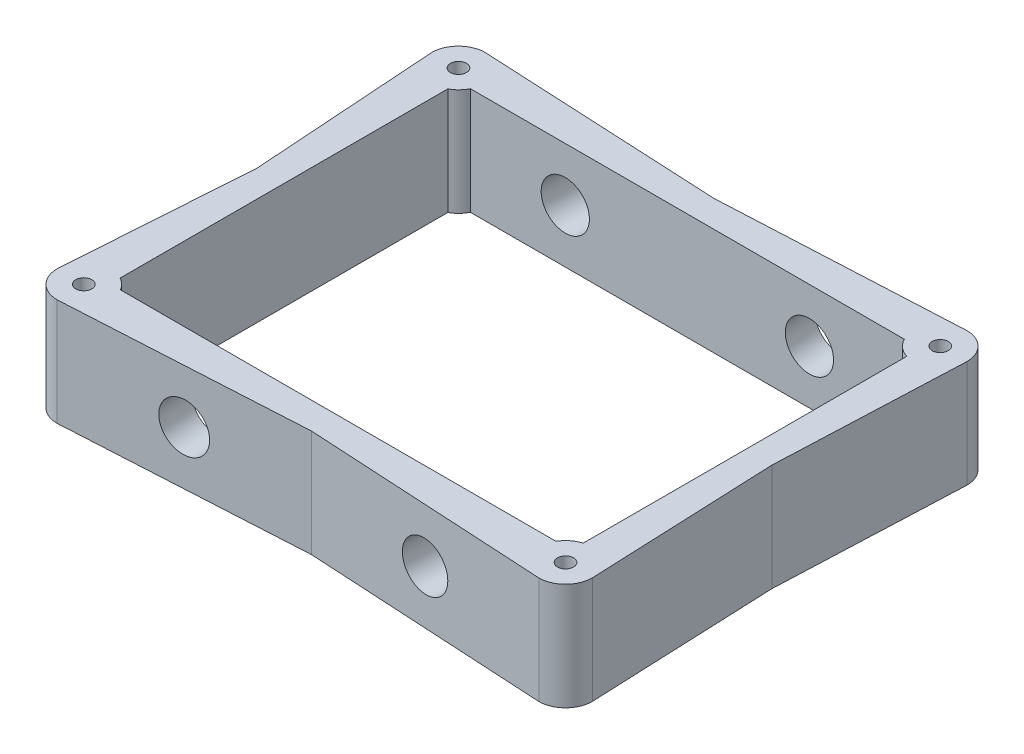
from build123d import *

# Parameters (mm, degrees)
SKETCH1_R                   = 1.5
BOSS_EXTRUDE3_DEPTH         = 20
M10X1_0_TAPPED_HOLE2_REACH  = 97.384
M10X1_0_TAPPED_HOLE2_BORE_R = 4.5
M10X1_0_TAPPED_HOLE3_REACH  = 97.384
M10X1_0_TAPPED_HOLE3_BORE_R = 4.5
M10X1_0_TAPPED_HOLE4_REACH  = 97.514
M10X1_0_TAPPED_HOLE4_BORE_R = 4.5
M10X1_0_TAPPED_HOLE5_REACH  = 97.514
M10X1_0_TAPPED_HOLE5_BORE_R = 4.5


with BuildPart() as part:
    # Sketch1 → Boss-Extrude3 (new body)
    with BuildSketch(Plane(origin=(0, 0, 0), x_dir=(1, 0, 0), z_dir=(0, 1, 0))):
        with BuildLine():
            Line((-44.503051854, 39.975242963), (-45, 40))
            ThreePointArc((-45, 40), (-48.535533906, 38.535533906), (-50, 35))
            Line((-50, 35), (-49.953621428, 34.32056292))
            Line((-49.953621428, 34.32056292), (-47.610889869, 0))
            Line((-47.610889869, 0), (-49.953621428, -34.32056292))
            Line((-49.953621428, -34.32056292), (-50, -35))
            ThreePointArc((-50, -35), (-48.535533906, -38.535533906), (-45, -40))
            Line((-45, -40), (0, -37.473505635))
            Line((0, -37.473505635), (45, -40))
            ThreePointArc((45, -40), (48.535533906, -38.535533906), (50, -35))
            Line((50, -35), (49.982372149, -34.580514872))
            Line((49.982372149, -34.580514872), (48.529209365, 0))
            Line((48.529209365, 0), (49.982372149, 34.580514872))
            Line((49.982372149, 34.580514872), (50, 35))
            ThreePointArc((50, 35), (48.535533906, 38.535533906), (45, 40))
            Line((45, 40), (44.503051854, 39.975242963))
            Line((44.503051854, 39.975242963), (0, 37.758183271))
            Line((0, 37.758183271), (-44.503051854, 39.975242963))
        make_face()
        with Locations(Location((-45, -35, 0), (0, 0, 270))):
            Circle(SKETCH1_R, mode=Mode.SUBTRACT)
        with Locations(Location((45, -35, 0), (0, 0, 270))):
            Circle(SKETCH1_R, mode=Mode.SUBTRACT)
        with Locations(Location((-45, 35, 0), (0, 0, 270))):
            Circle(SKETCH1_R, mode=Mode.SUBTRACT)
        with BuildLine():
            Line((40.685277967, -32.473505635), (-40.685277967, -32.473505635))
            ThreePointArc((-40.685277967, -32.473505635), (-41.520684905, -31.409127338), (-42.610889869, -30.607716678))
            Line((-42.610889869, -30.607716678), (-42.610889869, 30.607716678))
            ThreePointArc((-42.610889869, 30.607716678), (-41.406196107, 31.523712673), (-40.530743043, 32.758183271))
            Line((-40.530743043, 32.758183271), (40.530743043, 32.758183271))
            ThreePointArc((40.530743043, 32.758183271), (41.770434724, 31.182945097), (43.529209365, 30.221216169))
            Line((43.529209365, 30.221216169), (43.529209365, -30.221216169))
            ThreePointArc((43.529209365, -30.221216169), (41.895770439, -31.080336898), (40.685277967, -32.473505635))
        make_face(mode=Mode.SUBTRACT)
        with Locations(Location((45, 35, 0), (0, 0, 270))):
            Circle(SKETCH1_R, mode=Mode.SUBTRACT)
    extrude(amount=BOSS_EXTRUDE3_DEPTH)

    # M10x1.0 Tapped Hole2 bore → M10x1.0 Tapped Hole2 (cut, up to next)
    with BuildSketch(Plane(origin=(2.097313344, 0, 37.355753405), x_dir=(0.9984276240489233, 0, -0.05605603924665131), z_dir=(0.05605603924665131, 0, 0.9984276240489233)), mode=Mode.PRIVATE) as m10x1_0_tapped_hole2_sk1:
        with Locations((-24.636050477, 10)):
            Circle(M10X1_0_TAPPED_HOLE2_BORE_R)
    m10x1_0_tapped_hole2_tool1 = extrude(m10x1_0_tapped_hole2_sk1.sketch, amount=-M10X1_0_TAPPED_HOLE2_REACH, mode=Mode.PRIVATE) & part.part
    add(m10x1_0_tapped_hole2_tool1.solids().sort_by_distance((-22.5, 10, 38.736753))[0], mode=Mode.SUBTRACT)

    # M10x1.0 Tapped Hole3 bore → M10x1.0 Tapped Hole3 (cut, up to next)
    with BuildSketch(Plane(origin=(-2.097313344, 0, 37.355753405), x_dir=(0.9984276240489233, 0, 0.056056039246651354), z_dir=(-0.056056039246651354, 0, 0.9984276240489233)), mode=Mode.PRIVATE) as m10x1_0_tapped_hole3_sk1:
        with Locations((24.636050477, 10)):
            Circle(M10X1_0_TAPPED_HOLE3_BORE_R)
    m10x1_0_tapped_hole3_tool1 = extrude(m10x1_0_tapped_hole3_sk1.sketch, amount=-M10X1_0_TAPPED_HOLE3_REACH, mode=Mode.PRIVATE) & part.part
    add(m10x1_0_tapped_hole3_tool1.solids().sort_by_distance((22.5, 10, 38.736753))[0], mode=Mode.SUBTRACT)

    # M10x1.0 Tapped Hole4 bore → M10x1.0 Tapped Hole4 (cut, up to next)
    with BuildSketch(Plane(origin=(-1.876385916, 0, -37.664705196), x_dir=(-0.9987613810598752, 0, 0.049756443837666), z_dir=(-0.049756443837666, 0, -0.9987613810598752)), mode=Mode.PRIVATE) as m10x1_0_tapped_hole4_sk1:
        with Locations((-24.406616413, 10)):
            Circle(M10X1_0_TAPPED_HOLE4_BORE_R)
    m10x1_0_tapped_hole4_tool1 = extrude(m10x1_0_tapped_hole4_sk1.sketch, amount=-M10X1_0_TAPPED_HOLE4_REACH, mode=Mode.PRIVATE) & part.part
    add(m10x1_0_tapped_hole4_tool1.solids().sort_by_distance((22.5, 10, -38.879092))[0], mode=Mode.SUBTRACT)

    # M10x1.0 Tapped Hole5 bore → M10x1.0 Tapped Hole5 (cut, up to next)
    with BuildSketch(Plane(origin=(1.876385916, 0, -37.664705196), x_dir=(-0.9987613810598767, 0, -0.04975644383763697), z_dir=(0.049756443837636964, 0, -0.9987613810598766)), mode=Mode.PRIVATE) as m10x1_0_tapped_hole5_sk1:
        with Locations((24.406616413, 10)):
            Circle(M10X1_0_TAPPED_HOLE5_BORE_R)
    m10x1_0_tapped_hole5_tool1 = extrude(m10x1_0_tapped_hole5_sk1.sketch, amount=-M10X1_0_TAPPED_HOLE5_REACH, mode=Mode.PRIVATE) & part.part
    add(m10x1_0_tapped_hole5_tool1.solids().sort_by_distance((-22.5, 10, -38.879092))[0], mode=Mode.SUBTRACT)


solid = part.part
